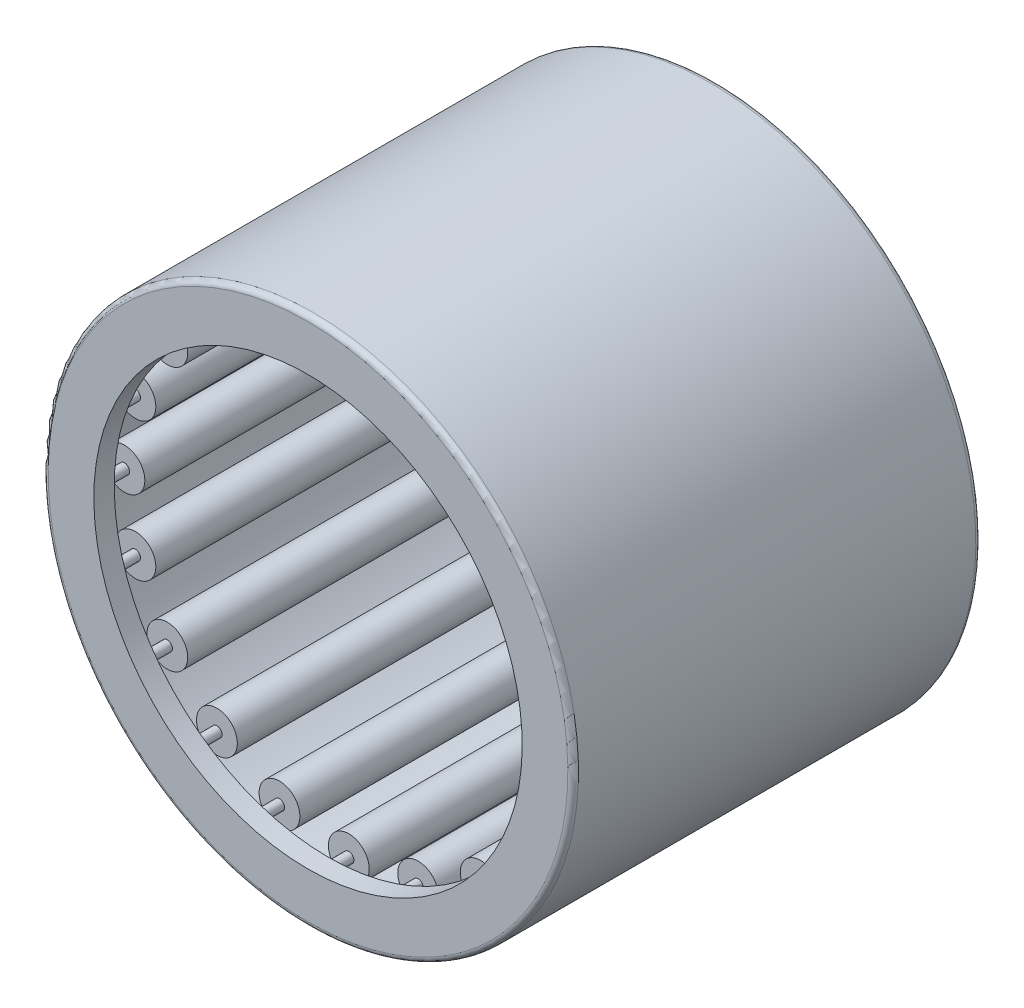
from build123d import *

# Parameters (mm, degrees)
SKETCH2_W         = 16
SKETCH2_H         = 0.75
SKETCH3_W         = 18
SKETCH3_H         = 0.25
CIRPATTERN1_COUNT = 20
CIRPATTERN1_ANGLE = 342
FILLET1_R         = 0.26


with BuildPart() as part:
    # Sketch7 → Revolve1 (revolve)
    with BuildSketch(Plane(origin=(0, 0, 0), x_dir=(0, 0, -1), z_dir=(1, 0, 0)), mode=Mode.PRIVATE) as revolve1_sk:
        Polygon((-10, 13), (-10, 10.5), (-9, 10.5), (-9, 12), (9, 12), (9, 10.5), (10, 10.5), (10, 13), align=None)
    revolve(revolve1_sk.sketch.rotate(Axis((0, 0, 10), (0, 0, -1)), 180), axis=Axis((0, 0, 10), (0, 0, -1)))

    # Fillet1
    fillet1_edges = [part.edges().sort_by_distance(p)[0] for p in [
        (0, 13, -10),
        (0, 13, 10),
    ]]
    fillet(fillet1_edges, radius=FILLET1_R)


with BuildPart() as body_2:
    # Sketch2 → Revolve2 (revolve)
    with BuildSketch(Plane(origin=(0, 0, 0), x_dir=(0, 0, -1), z_dir=(1, 0, 0)), mode=Mode.PRIVATE) as revolve2_sk:
        with Locations((0, 11.625)):
            Rectangle(SKETCH2_W, SKETCH2_H)
    revolve(revolve2_sk.sketch.rotate(Axis((0, 11, 8), (0, 0, -1)), 180), axis=Axis((0, 11, 8), (0, 0, -1)))


with BuildPart() as body_3:
    # Sketch3 → Revolve3 (revolve)
    with BuildSketch(Plane(origin=(0, 0, 0), x_dir=(0, 0, -1), z_dir=(1, 0, 0)), mode=Mode.PRIVATE) as revolve3_sk:
        with Locations((0, 11.125)):
            Rectangle(SKETCH3_W, SKETCH3_H)
    revolve(revolve3_sk.sketch.rotate(Axis((0, 11, 9), (0, 0, -1)), 90), axis=Axis((0, 11, 9), (0, 0, -1)))


with BuildPart() as cirpattern1_1:
    # CirPattern1: pattern copy
    add(body_2.part.rotate(Axis((0, 0, 10), (0, 0, -1)), 1 * CIRPATTERN1_ANGLE / (CIRPATTERN1_COUNT - 1)))


with BuildPart() as cirpattern1_2:
    # CirPattern1: pattern copy
    add(body_2.part.rotate(Axis((0, 0, 10), (0, 0, -1)), 2 * CIRPATTERN1_ANGLE / (CIRPATTERN1_COUNT - 1)))


with BuildPart() as cirpattern1_3:
    # CirPattern1: pattern copy
    add(body_2.part.rotate(Axis((0, 0, 10), (0, 0, -1)), 3 * CIRPATTERN1_ANGLE / (CIRPATTERN1_COUNT - 1)))


with BuildPart() as cirpattern1_4:
    # CirPattern1: pattern copy
    add(body_2.part.rotate(Axis((0, 0, 10), (0, 0, -1)), 4 * CIRPATTERN1_ANGLE / (CIRPATTERN1_COUNT - 1)))


with BuildPart() as cirpattern1_5:
    # CirPattern1: pattern copy
    add(body_2.part.rotate(Axis((0, 0, 10), (0, 0, -1)), 5 * CIRPATTERN1_ANGLE / (CIRPATTERN1_COUNT - 1)))


with BuildPart() as cirpattern1_6:
    # CirPattern1: pattern copy
    add(body_2.part.rotate(Axis((0, 0, 10), (0, 0, -1)), 6 * CIRPATTERN1_ANGLE / (CIRPATTERN1_COUNT - 1)))


with BuildPart() as cirpattern1_7:
    # CirPattern1: pattern copy
    add(body_2.part.rotate(Axis((0, 0, 10), (0, 0, -1)), 7 * CIRPATTERN1_ANGLE / (CIRPATTERN1_COUNT - 1)))


with BuildPart() as cirpattern1_8:
    # CirPattern1: pattern copy
    add(body_2.part.rotate(Axis((0, 0, 10), (0, 0, -1)), 8 * CIRPATTERN1_ANGLE / (CIRPATTERN1_COUNT - 1)))


with BuildPart() as cirpattern1_9:
    # CirPattern1: pattern copy
    add(body_2.part.rotate(Axis((0, 0, 10), (0, 0, -1)), 9 * CIRPATTERN1_ANGLE / (CIRPATTERN1_COUNT - 1)))


with BuildPart() as cirpattern1_10:
    # CirPattern1: pattern copy
    add(body_2.part.rotate(Axis((0, 0, 10), (0, 0, -1)), 10 * CIRPATTERN1_ANGLE / (CIRPATTERN1_COUNT - 1)))


with BuildPart() as cirpattern1_11:
    # CirPattern1: pattern copy
    add(body_2.part.rotate(Axis((0, 0, 10), (0, 0, -1)), 11 * CIRPATTERN1_ANGLE / (CIRPATTERN1_COUNT - 1)))


with BuildPart() as cirpattern1_12:
    # CirPattern1: pattern copy
    add(body_2.part.rotate(Axis((0, 0, 10), (0, 0, -1)), 12 * CIRPATTERN1_ANGLE / (CIRPATTERN1_COUNT - 1)))


with BuildPart() as cirpattern1_13:
    # CirPattern1: pattern copy
    add(body_2.part.rotate(Axis((0, 0, 10), (0, 0, -1)), 13 * CIRPATTERN1_ANGLE / (CIRPATTERN1_COUNT - 1)))


with BuildPart() as cirpattern1_14:
    # CirPattern1: pattern copy
    add(body_2.part.rotate(Axis((0, 0, 10), (0, 0, -1)), 14 * CIRPATTERN1_ANGLE / (CIRPATTERN1_COUNT - 1)))


with BuildPart() as cirpattern1_15:
    # CirPattern1: pattern copy
    add(body_2.part.rotate(Axis((0, 0, 10), (0, 0, -1)), 15 * CIRPATTERN1_ANGLE / (CIRPATTERN1_COUNT - 1)))


with BuildPart() as cirpattern1_16:
    # CirPattern1: pattern copy
    add(body_2.part.rotate(Axis((0, 0, 10), (0, 0, -1)), 16 * CIRPATTERN1_ANGLE / (CIRPATTERN1_COUNT - 1)))


with BuildPart() as cirpattern1_17:
    # CirPattern1: pattern copy
    add(body_2.part.rotate(Axis((0, 0, 10), (0, 0, -1)), 17 * CIRPATTERN1_ANGLE / (CIRPATTERN1_COUNT - 1)))


with BuildPart() as cirpattern1_18:
    # CirPattern1: pattern copy
    add(body_2.part.rotate(Axis((0, 0, 10), (0, 0, -1)), 18 * CIRPATTERN1_ANGLE / (CIRPATTERN1_COUNT - 1)))


with BuildPart() as cirpattern1_19:
    # CirPattern1: pattern copy
    add(body_2.part.rotate(Axis((0, 0, 10), (0, 0, -1)), 19 * CIRPATTERN1_ANGLE / (CIRPATTERN1_COUNT - 1)))


with BuildPart() as cirpattern1_20:
    # CirPattern1: pattern copy
    add(body_3.part.rotate(Axis((0, 0, 10), (0, 0, -1)), 1 * CIRPATTERN1_ANGLE / (CIRPATTERN1_COUNT - 1)))


with BuildPart() as cirpattern1_21:
    # CirPattern1: pattern copy
    add(body_3.part.rotate(Axis((0, 0, 10), (0, 0, -1)), 2 * CIRPATTERN1_ANGLE / (CIRPATTERN1_COUNT - 1)))


with BuildPart() as cirpattern1_22:
    # CirPattern1: pattern copy
    add(body_3.part.rotate(Axis((0, 0, 10), (0, 0, -1)), 3 * CIRPATTERN1_ANGLE / (CIRPATTERN1_COUNT - 1)))


with BuildPart() as cirpattern1_23:
    # CirPattern1: pattern copy
    add(body_3.part.rotate(Axis((0, 0, 10), (0, 0, -1)), 4 * CIRPATTERN1_ANGLE / (CIRPATTERN1_COUNT - 1)))


with BuildPart() as cirpattern1_24:
    # CirPattern1: pattern copy
    add(body_3.part.rotate(Axis((0, 0, 10), (0, 0, -1)), 5 * CIRPATTERN1_ANGLE / (CIRPATTERN1_COUNT - 1)))


with BuildPart() as cirpattern1_25:
    # CirPattern1: pattern copy
    add(body_3.part.rotate(Axis((0, 0, 10), (0, 0, -1)), 6 * CIRPATTERN1_ANGLE / (CIRPATTERN1_COUNT - 1)))


with BuildPart() as cirpattern1_26:
    # CirPattern1: pattern copy
    add(body_3.part.rotate(Axis((0, 0, 10), (0, 0, -1)), 7 * CIRPATTERN1_ANGLE / (CIRPATTERN1_COUNT - 1)))


with BuildPart() as cirpattern1_27:
    # CirPattern1: pattern copy
    add(body_3.part.rotate(Axis((0, 0, 10), (0, 0, -1)), 8 * CIRPATTERN1_ANGLE / (CIRPATTERN1_COUNT - 1)))


with BuildPart() as cirpattern1_28:
    # CirPattern1: pattern copy
    add(body_3.part.rotate(Axis((0, 0, 10), (0, 0, -1)), 9 * CIRPATTERN1_ANGLE / (CIRPATTERN1_COUNT - 1)))


with BuildPart() as cirpattern1_29:
    # CirPattern1: pattern copy
    add(body_3.part.rotate(Axis((0, 0, 10), (0, 0, -1)), 10 * CIRPATTERN1_ANGLE / (CIRPATTERN1_COUNT - 1)))


with BuildPart() as cirpattern1_30:
    # CirPattern1: pattern copy
    add(body_3.part.rotate(Axis((0, 0, 10), (0, 0, -1)), 11 * CIRPATTERN1_ANGLE / (CIRPATTERN1_COUNT - 1)))


with BuildPart() as cirpattern1_31:
    # CirPattern1: pattern copy
    add(body_3.part.rotate(Axis((0, 0, 10), (0, 0, -1)), 12 * CIRPATTERN1_ANGLE / (CIRPATTERN1_COUNT - 1)))


with BuildPart() as cirpattern1_32:
    # CirPattern1: pattern copy
    add(body_3.part.rotate(Axis((0, 0, 10), (0, 0, -1)), 13 * CIRPATTERN1_ANGLE / (CIRPATTERN1_COUNT - 1)))


with BuildPart() as cirpattern1_33:
    # CirPattern1: pattern copy
    add(body_3.part.rotate(Axis((0, 0, 10), (0, 0, -1)), 14 * CIRPATTERN1_ANGLE / (CIRPATTERN1_COUNT - 1)))


with BuildPart() as cirpattern1_34:
    # CirPattern1: pattern copy
    add(body_3.part.rotate(Axis((0, 0, 10), (0, 0, -1)), 15 * CIRPATTERN1_ANGLE / (CIRPATTERN1_COUNT - 1)))


with BuildPart() as cirpattern1_35:
    # CirPattern1: pattern copy
    add(body_3.part.rotate(Axis((0, 0, 10), (0, 0, -1)), 16 * CIRPATTERN1_ANGLE / (CIRPATTERN1_COUNT - 1)))


with BuildPart() as cirpattern1_36:
    # CirPattern1: pattern copy
    add(body_3.part.rotate(Axis((0, 0, 10), (0, 0, -1)), 17 * CIRPATTERN1_ANGLE / (CIRPATTERN1_COUNT - 1)))


with BuildPart() as cirpattern1_37:
    # CirPattern1: pattern copy
    add(body_3.part.rotate(Axis((0, 0, 10), (0, 0, -1)), 18 * CIRPATTERN1_ANGLE / (CIRPATTERN1_COUNT - 1)))


with BuildPart() as cirpattern1_38:
    # CirPattern1: pattern copy
    add(body_3.part.rotate(Axis((0, 0, 10), (0, 0, -1)), 19 * CIRPATTERN1_ANGLE / (CIRPATTERN1_COUNT - 1)))


solid = Compound([part.part, body_2.part, body_3.part, cirpattern1_1.part, cirpattern1_2.part, cirpattern1_3.part, cirpattern1_4.part, cirpattern1_5.part, cirpattern1_6.part, cirpattern1_7.part, cirpattern1_8.part, cirpattern1_9.part, cirpattern1_10.part, cirpattern1_11.part, cirpattern1_12.part, cirpattern1_13.part, cirpattern1_14.part, cirpattern1_15.part, cirpattern1_16.part, cirpattern1_17.part, cirpattern1_18.part, cirpattern1_19.part, cirpattern1_20.part, cirpattern1_21.part, cirpattern1_22.part, cirpattern1_23.part, cirpattern1_24.part, cirpattern1_25.part, cirpattern1_26.part, cirpattern1_27.part, cirpattern1_28.part, cirpattern1_29.part, cirpattern1_30.part, cirpattern1_31.part, cirpattern1_32.part, cirpattern1_33.part, cirpattern1_34.part, cirpattern1_35.part, cirpattern1_36.part, cirpattern1_37.part, cirpattern1_38.part])
